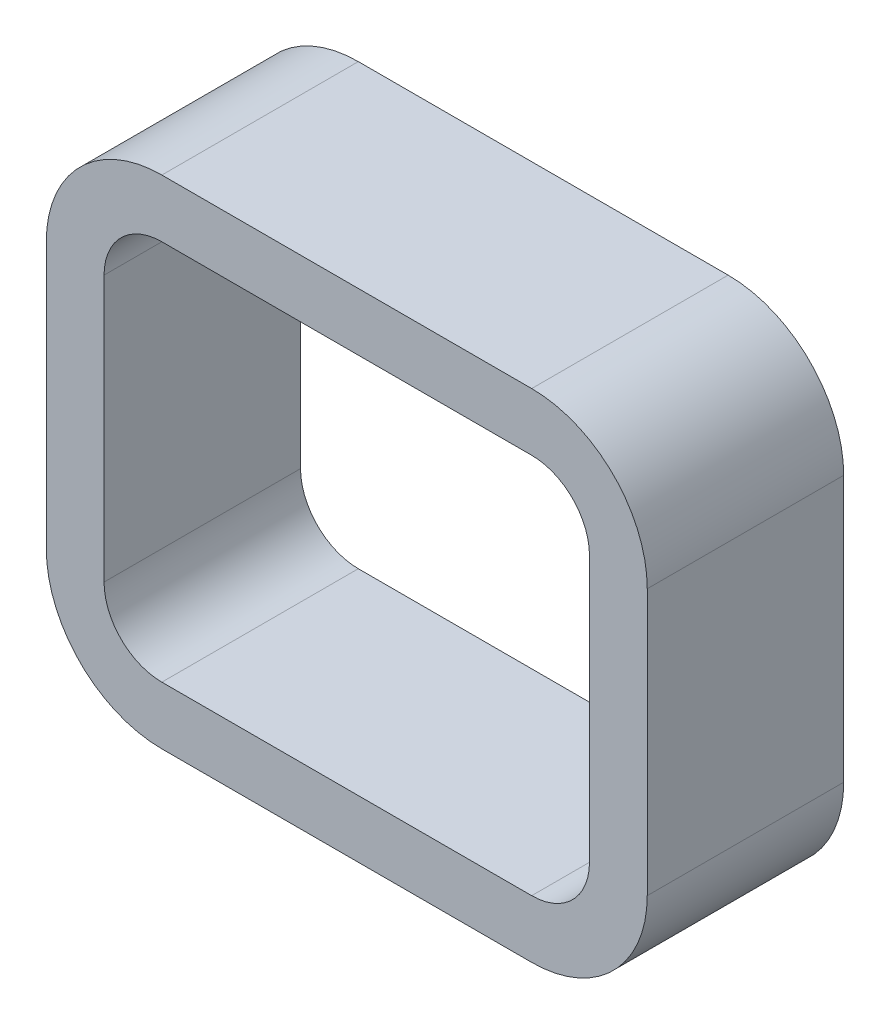
from build123d import *

# Parameters (mm, degrees)
EXTRUDE_THIN3_DEPTH = 17


with BuildPart() as part:
    # Sketch1 → Extrude-Thin3 (new body)
    with BuildSketch(Plane.XY):
        with BuildLine():
            Line((-33.207679085, -17.13683434), (-1.207679085, -17.13683434))
            ThreePointArc((-1.207679085, -17.13683434), (5.863388726, -14.207902152), (8.792320915, -7.13683434))
            Line((8.792320915, -7.13683434), (8.792320915, 15.86316566))
            ThreePointArc((8.792320915, 15.86316566), (5.863388726, 22.934233472), (-1.207679085, 25.86316566))
            Line((-1.207679085, 25.86316566), (-33.207679085, 25.86316566))
            ThreePointArc((-33.207679085, 25.86316566), (-40.278746897, 22.934233472), (-43.207679085, 15.86316566))
            Line((-43.207679085, 15.86316566), (-43.207679085, -7.13683434))
            ThreePointArc((-43.207679085, -7.13683434), (-40.278746897, -14.207902152), (-33.207679085, -17.13683434))
        make_face()
        with BuildLine():
            Line((-33.207679085, -12.13683434), (-1.207679085, -12.13683434))
            ThreePointArc((-1.207679085, -12.13683434), (2.327854821, -10.672368246), (3.792320915, -7.13683434))
            Line((3.792320915, -7.13683434), (3.792320915, 15.86316566))
            ThreePointArc((3.792320915, 15.86316566), (2.327854821, 19.398699566), (-1.207679085, 20.86316566))
            Line((-1.207679085, 20.86316566), (-33.207679085, 20.86316566))
            ThreePointArc((-33.207679085, 20.86316566), (-36.743212991, 19.398699566), (-38.207679085, 15.86316566))
            Line((-38.207679085, 15.86316566), (-38.207679085, -7.13683434))
            ThreePointArc((-38.207679085, -7.13683434), (-36.743212991, -10.672368246), (-33.207679085, -12.13683434))
        make_face(mode=Mode.SUBTRACT)
    extrude(amount=EXTRUDE_THIN3_DEPTH)


solid = part.part
